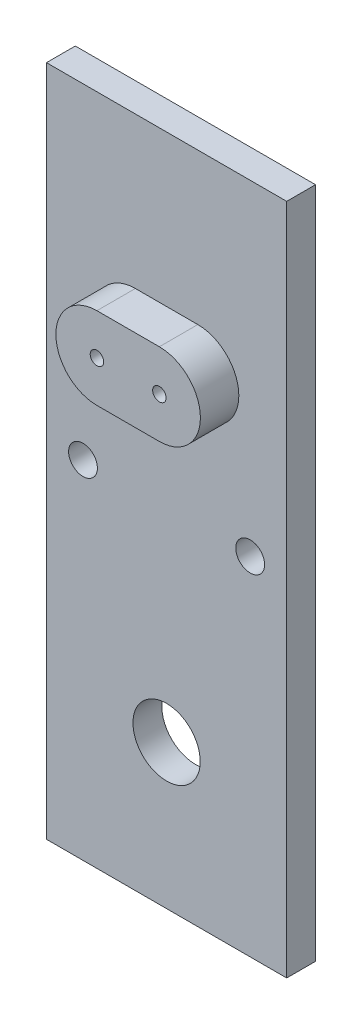
from build123d import *

# Parameters (mm, degrees)
SKETCH1_W           = 25
SKETCH1_H           = 70
SKETCH1_R           = 1.5
SKETCH1_R_2         = 3.5
BOSS_EXTRUDE1_DEPTH = 3
CUT_EXTRUDE1_REACH  = 39.286
SKETCH3_R           = 0.7
BOSS_EXTRUDE2_START = 4
SKETCH4_R           = 0.7
BOSS_EXTRUDE2_DEPTH = 4


with BuildPart() as part:
    # Sketch1 → Boss-Extrude1 (new body)
    with BuildSketch(Plane.XY):
        Rectangle(SKETCH1_W, SKETCH1_H)
        with Locations((-8.7, 1.1)):
            Circle(SKETCH1_R, mode=Mode.SUBTRACT)
        with Locations((0, -20)):
            Circle(SKETCH1_R_2, mode=Mode.SUBTRACT)
        with Locations(Location((8.7, 1.1, 0), (0, 0, 180))):
            Circle(SKETCH1_R, mode=Mode.SUBTRACT)
    extrude(amount=BOSS_EXTRUDE1_DEPTH)

    # Sketch3 → Cut-Extrude1 (cut, up to next)
    with BuildSketch(Plane.XY.offset(3), mode=Mode.PRIVATE) as cut_extrude1_sk1:
        with Locations((-3.25, 15)):
            Circle(SKETCH3_R)
    cut_extrude1_tool1 = extrude(cut_extrude1_sk1.sketch, amount=-CUT_EXTRUDE1_REACH, mode=Mode.PRIVATE) & part.part
    # Sketch3 → Cut-Extrude1 (cut, up to next)
    with BuildSketch(Plane.XY.offset(3), mode=Mode.PRIVATE) as cut_extrude1_sk2:
        with Locations((3.25, 15)):
            Circle(SKETCH3_R)
    cut_extrude1_tool2 = extrude(cut_extrude1_sk2.sketch, amount=-CUT_EXTRUDE1_REACH, mode=Mode.PRIVATE) & part.part
    add(cut_extrude1_tool1.solids().sort_by_distance((-3.25, 15, 3))[0], mode=Mode.SUBTRACT)
    add(cut_extrude1_tool2.solids().sort_by_distance((3.25, 15, 3))[0], mode=Mode.SUBTRACT)

    # Sketch4 → Boss-Extrude2 (add)
    with BuildSketch(Plane.XY.offset(3).offset(BOSS_EXTRUDE2_START)):
        with BuildLine():
            Line((-3.25, 19.269172648), (3.25, 19.269172648))
            ThreePointArc((3.25, 19.269172648), (7.519172648, 15), (3.25, 10.730827352))
            Line((3.25, 10.730827352), (-3.25, 10.730827352))
            ThreePointArc((-3.25, 10.730827352), (-7.519172648, 15), (-3.25, 19.269172648))
        make_face()
        with Locations((-3.25, 15)):
            Circle(SKETCH4_R, mode=Mode.SUBTRACT)
        with Locations((3.25, 15)):
            Circle(SKETCH4_R, mode=Mode.SUBTRACT)
    extrude(amount=-BOSS_EXTRUDE2_DEPTH)


solid = part.part
